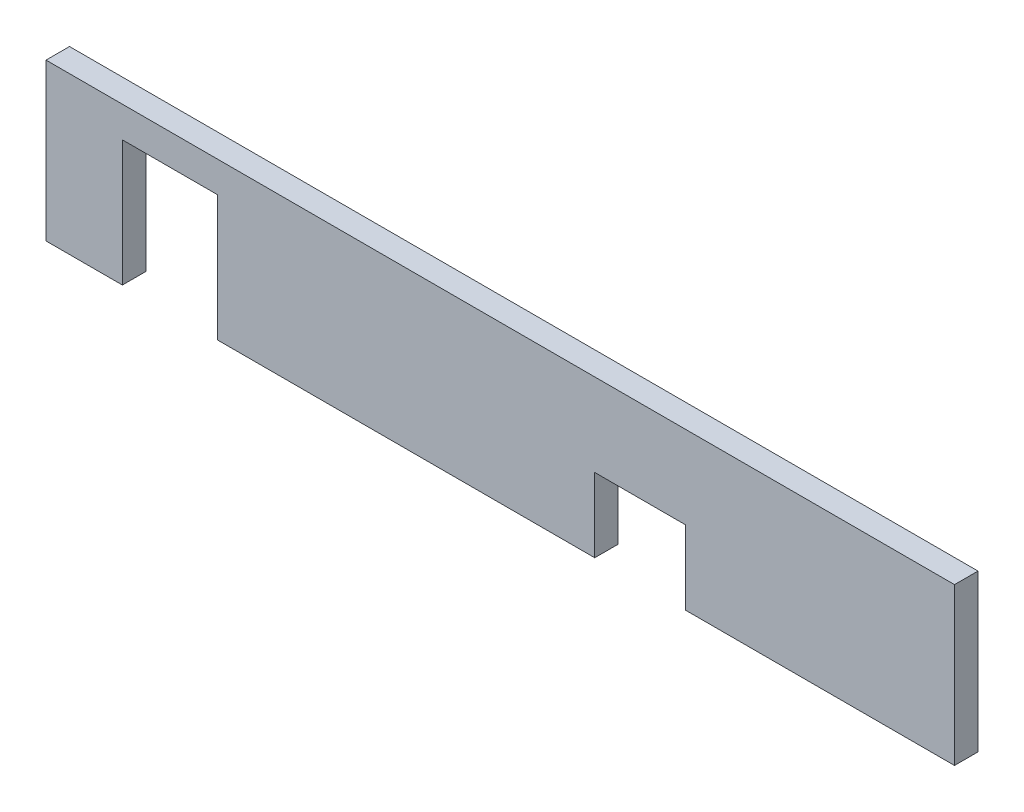
from build123d import *

# Parameters (mm, degrees)
BOSS_EXTRUDE1_DEPTH = 3


with BuildPart() as part:
    # Sketch1 → Boss-Extrude1 (new body)
    with BuildSketch(Plane.XY):
        Polygon((0, 0), (9.75317906, 0), (9.75317906, 16.060950102), (21.884832768, 16.060950102), (21.884832768, 0), (70.064689103, 0), (70.064689103, 9.436565379), (81.621585488, 9.436565379), (81.621585488, 0), (116, 0), (116, 20), (0, 20), align=None)
    extrude(amount=BOSS_EXTRUDE1_DEPTH)


solid = part.part
